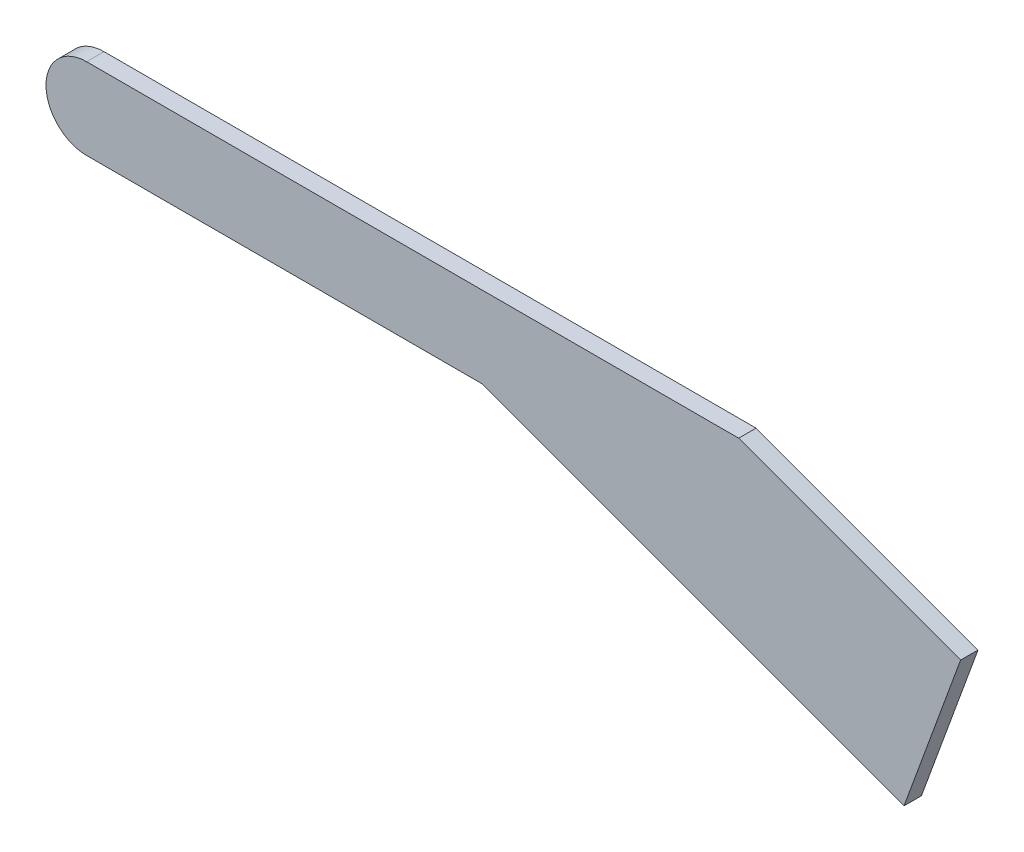
from build123d import *

# Parameters (mm, degrees)
RESSALTO_EXTRUS_O1_DEPTH = 1.5


with BuildPart() as part:
    # Esboço1 → Ressalto-extrusão1 (new body)
    with BuildSketch(Plane.XY):
        with BuildLine():
            Line((56.198372015, 3.5), (0, 3.5))
            ThreePointArc((0, 3.5), (-3.5, 0), (0, -3.5))
            Line((0, -3.5), (34.060756458, -3.5))
            Line((34.060756458, -3.5), (70.446894759, -16.818719017))
            Line((70.446894759, -16.818719017), (75.32205559, -3.5))
            Line((75.32205559, -3.5), (56.198372015, 3.5))
        make_face()
    extrude(amount=RESSALTO_EXTRUS_O1_DEPTH)


solid = part.part
